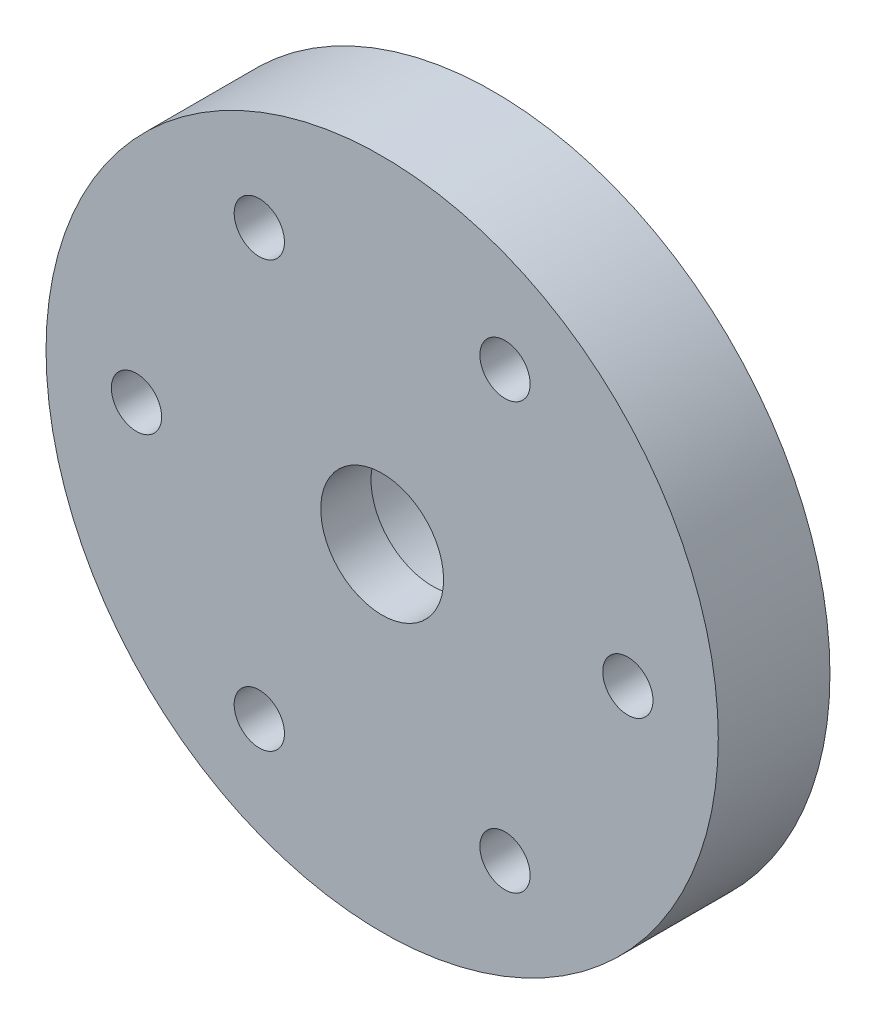
from build123d import *

# Parameters (mm, degrees)
ESQUISSE1_R        = 30.1
ESQUISSE1_R_2      = 2.25
ESQUISSE1_R_3      = 8.1
BOSS_EXTRU_1_DEPTH = 10
BOSS_EXTRU_2_START = -4.5
ESQUISSE2_R        = 8.1
ESQUISSE2_R_2      = 5.5
BOSS_EXTRU_2_DEPTH = 4.5


with BuildPart() as part:
    # Esquisse1 → Boss.-Extru.1 (new body)
    with BuildSketch(Plane.XY):
        Circle(ESQUISSE1_R)
        with Locations((22, 0)):
            Circle(ESQUISSE1_R_2, mode=Mode.SUBTRACT)
        with Locations((11, -19.052558883)):
            Circle(ESQUISSE1_R_2, mode=Mode.SUBTRACT)
        with Locations((-11, -19.052558883)):
            Circle(ESQUISSE1_R_2, mode=Mode.SUBTRACT)
        with Locations((-22, 0)):
            Circle(ESQUISSE1_R_2, mode=Mode.SUBTRACT)
        with Locations((-11, 19.052558883)):
            Circle(ESQUISSE1_R_2, mode=Mode.SUBTRACT)
        with Locations((11, 19.052558883)):
            Circle(ESQUISSE1_R_2, mode=Mode.SUBTRACT)
        Circle(ESQUISSE1_R_3, mode=Mode.SUBTRACT)
    extrude(amount=BOSS_EXTRU_1_DEPTH)

    # Esquisse2 → Boss.-Extru.2 (add)
    with BuildSketch(Plane.XY.offset(10).offset(BOSS_EXTRU_2_START)):
        Circle(ESQUISSE2_R)
        Circle(ESQUISSE2_R_2, mode=Mode.SUBTRACT)
    extrude(amount=BOSS_EXTRU_2_DEPTH)


solid = part.part
